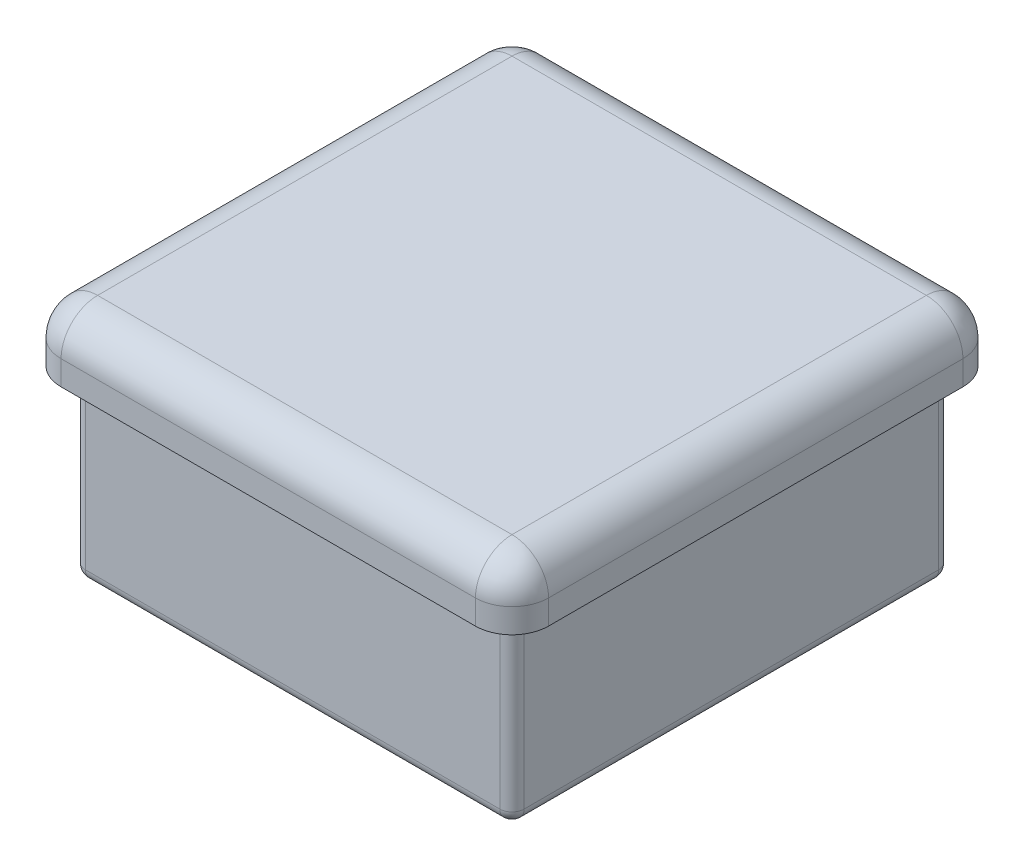
from build123d import *

# Parameters (mm, degrees)
ESBO_O1_W                = 40
ESBO_O1_H                = 40
RESSALTO_EXTRUS_O1_DEPTH = 2.5
FILETE1_R                = 3
FILETE2_R                = 3
ESBO_O2_W                = 31
ESBO_O2_H                = 31
RESSALTO_EXTRUS_O2_DEPTH = 15
FILETE3_R                = 1
FILETE4_R                = 1


with BuildPart() as part:
    # Esboço1 → Ressalto-extrusão1 (new, symmetric)
    with BuildSketch(Plane(origin=(0, 0, 0), x_dir=(1, 0, 0), z_dir=(0, 1, 0))):
        Rectangle(ESBO_O1_W, ESBO_O1_H)
    extrude(amount=RESSALTO_EXTRUS_O1_DEPTH, both=True)

    # Filete1
    filete1_edges = [part.edges().sort_by_distance(p)[0] for p in [
        (-20, 0, -20),
        (20, 0, -20),
        (20, 0, 20),
        (-20, 0, 20),
    ]]
    fillet(filete1_edges, radius=FILETE1_R)

    # Filete2
    filete2_edges = [part.edges().sort_by_distance(p)[0] for p in [
        (-20, 2.5, 0),
        (0, 2.5, -20),
        (0, 2.5, 20),
        (20, 2.5, 0),
        (19.121320344, 2.5, 19.121320344),
        (-19.121320344, 2.5, 19.121320344),
        (19.121320344, 2.5, -19.121320344),
        (-19.121320344, 2.5, -19.121320344),
    ]]
    fillet(filete2_edges, radius=FILETE2_R)

    # Esboço2 → Ressalto-extrusão2 (add)
    with BuildSketch(Plane.XZ.offset(2.5)):
        with BuildLine():
            Line((-18, 17), (-18, -17))
            ThreePointArc((-18, -17), (-17.707106781, -17.707106781), (-17, -18))
            Line((-17, -18), (17, -18))
            ThreePointArc((17, -18), (17.707106781, -17.707106781), (18, -17))
            Line((18, -17), (18, 17))
            ThreePointArc((18, 17), (17.707106781, 17.707106781), (17, 18))
            Line((17, 18), (-17, 18))
            ThreePointArc((-17, 18), (-17.707106781, 17.707106781), (-18, 17))
        make_face()
        Rectangle(ESBO_O2_W, ESBO_O2_H, mode=Mode.SUBTRACT)
    extrude(amount=RESSALTO_EXTRUS_O2_DEPTH)

    # Filete3
    filete3_edges = [part.edges().sort_by_distance(p)[0] for p in [
        (-15.5, -10, 15.5),
        (-15.5, -10, -15.5),
        (15.5, -10, -15.5),
        (15.5, -10, 15.5),
    ]]
    fillet(filete3_edges, radius=FILETE3_R)

    # Filete4
    filete4_edges = [part.edges().sort_by_distance(p)[0] for p in [
        (15.5, -17.5, 0),
        (-15.5, -17.5, 0),
        (0, -17.5, 15.5),
        (15.207106781, -17.5, -15.207106781),
        (-15.207106781, -17.5, -15.207106781),
        (15.207106781, -17.5, 15.207106781),
        (-15.207106781, -17.5, 15.207106781),
        (-17.707106781, -17.5, 17.707106781),
        (-18, -17.5, 0),
        (-17.707106781, -17.5, -17.707106781),
        (0, -17.5, -18),
        (17.707106781, -17.5, -17.707106781),
        (18, -17.5, 0),
        (17.707106781, -17.5, 17.707106781),
        (0, -17.5, 18),
        (0, -17.5, -15.5),
    ]]
    fillet(filete4_edges, radius=FILETE4_R)


solid = part.part
